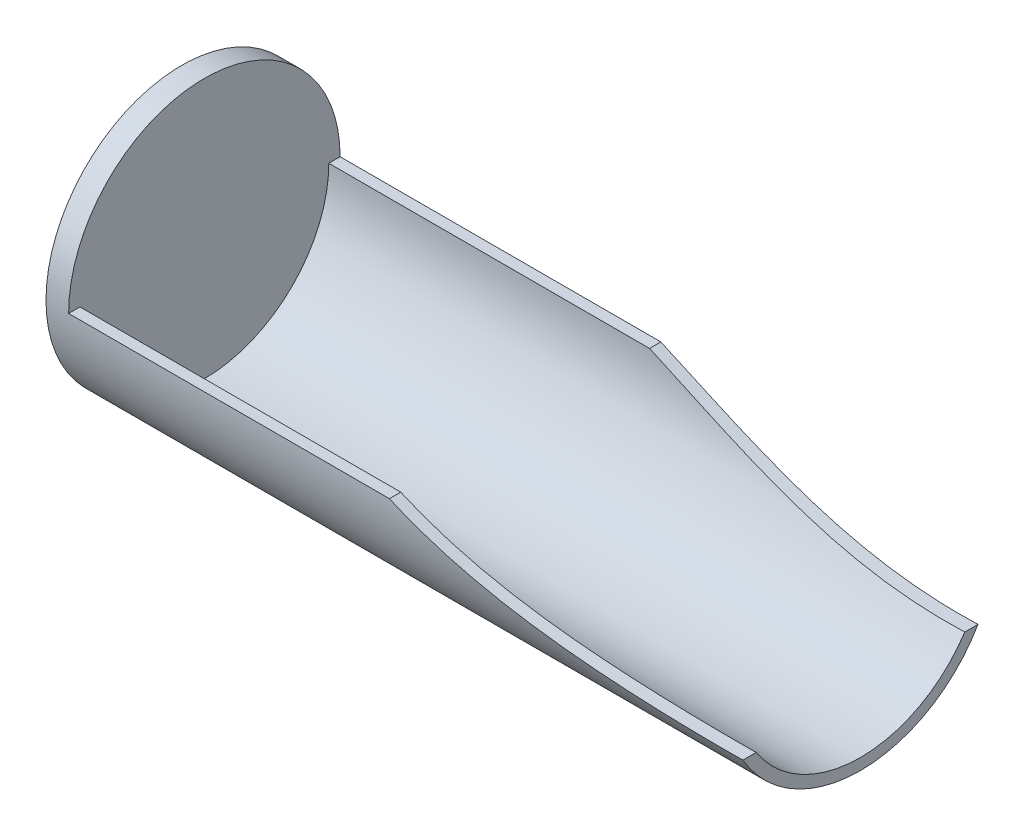
from build123d import *

# Parameters (mm, degrees)
SKETCH1_R               = 120
BOSS_EXTRUDE1_DEPTH     = 600
CUT_EXTRUDE1_START      = -580
CUT_EXTRUDE1_DEPTH      = 580
CUT_EXTRUDE3_DEPTH      = 624.538290725
CUT_EXTRUDE3_DEPTH_BACK = 624.538290725


with BuildPart() as part:
    # Sketch1 → Boss-Extrude1 (new body)
    with BuildSketch(Plane(origin=(0, 0, 0), x_dir=(0, 0, -1), z_dir=(1, 0, 0))):
        Circle(SKETCH1_R)
    extrude(amount=BOSS_EXTRUDE1_DEPTH)

    # Sketch2 → Cut-Extrude1 (cut)
    with BuildSketch(Plane(origin=(600, 0, 0), x_dir=(0, 0, -1), z_dir=(1, 0, 0)).offset(CUT_EXTRUDE1_START)):
        with BuildLine():
            Line((-110, 0), (-120, 0))
            ThreePointArc((-120, 0), (0, 120), (120, 0))
            Line((120, 0), (110, 0))
            ThreePointArc((110, 0), (0, -110), (-110, 0))
        make_face()
    extrude(amount=CUT_EXTRUDE1_DEPTH, mode=Mode.SUBTRACT)

    # Sketch5 → Cut-Extrude3 (cut, two sides: drawn at the far end of the back side and taken through both)
    with BuildSketch(Plane.XY.offset(-CUT_EXTRUDE3_DEPTH_BACK)):
        with BuildLine():
            Line((303.579878798, 0), (600, 0))
            Line((600, 0), (600, -60))
            add(Edge.make_bspline(
                [(303.579878798, 0), (445.56940812, -63.340252394), (600, -60)],
                knots=[0, 0, 0, 1, 1, 1], degree=2))
        make_face()
    extrude(amount=CUT_EXTRUDE3_DEPTH + CUT_EXTRUDE3_DEPTH_BACK, mode=Mode.SUBTRACT)


solid = part.part
